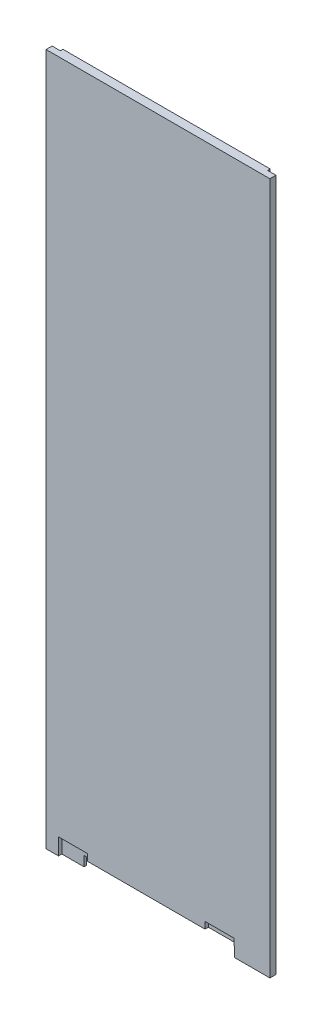
from build123d import *

# Parameters (mm, degrees)
SKETCH1_W           = 108
SKETCH1_H           = 334
BOSS_EXTRUDE1_DEPTH = 2.921
SKETCH2_W           = 74.2
SKETCH2_H           = 4.75075517
CUT_EXTRUDE1_DEPTH  = 176.537837064
SKETCH3_W           = 14
SKETCH3_H           = 1.608195067
CUT_EXTRUDE2_DEPTH  = 8
SKETCH4_W           = 100
SKETCH4_H           = 1.25
BOSS_EXTRUDE2_DEPTH = 2


with BuildPart() as part:
    # Sketch1 → Boss-Extrude1 (new body)
    with BuildSketch(Plane.XY):
        Rectangle(SKETCH1_W, SKETCH1_H)
    extrude(amount=BOSS_EXTRUDE1_DEPTH)

    # Sketch2 → Cut-Extrude1 (cut, through all)
    with BuildSketch(Plane.XY.offset(2.921)):
        with Locations((-0.22, -164.624622415)):
            Rectangle(SKETCH2_W, SKETCH2_H)
    extrude(amount=-CUT_EXTRUDE1_DEPTH, mode=Mode.SUBTRACT)

    # Sketch3 → Cut-Extrude2 (cut)
    with BuildSketch(Plane.XZ.offset(167)):
        with Locations((29.682997172, 2.116902467)):
            Rectangle(SKETCH3_W, SKETCH3_H)
        with Locations((-41, 2.116902467)):
            Rectangle(SKETCH3_W, SKETCH3_H)
    extrude(amount=-CUT_EXTRUDE2_DEPTH, mode=Mode.SUBTRACT)

    # Sketch4 → Boss-Extrude2 (add)
    with BuildSketch(Plane(origin=(0, 167, 0), x_dir=(1, 0, 0), z_dir=(0, 1, 0))):
        with Locations((0, 0.625)):
            Rectangle(SKETCH4_W, SKETCH4_H)
    extrude(amount=-BOSS_EXTRUDE2_DEPTH)


solid = part.part
